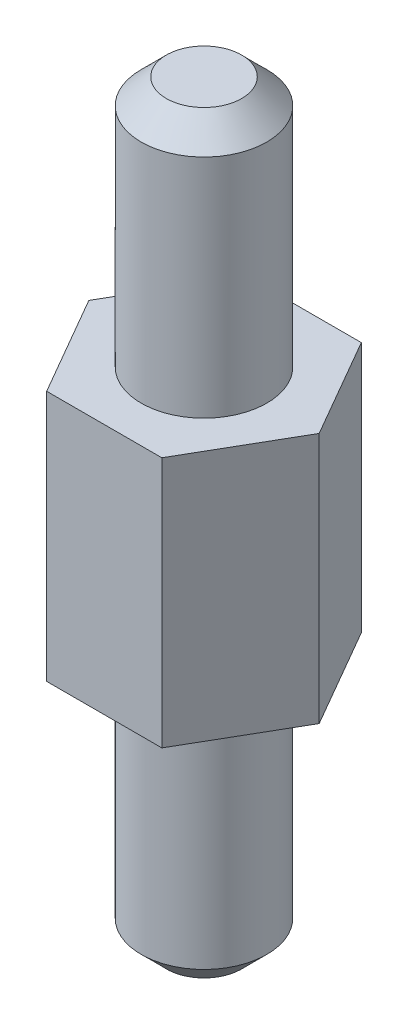
from build123d import *

# Parameters (mm, degrees)
EXTRUDE_1_DEPTH = 6
SKETCH_3_R      = 1.5
EXTRUDE_2_DEPTH = 6
EXTRUDE_START   = 6
SKETCH_4_R      = 1.5
EXTRUDE_3_DEPTH = 6
CHAMFER_1_SIZE  = 0.6


with BuildPart() as part:
    # Эскиз1 → Бобышка-Вытянуть1 (new body)
    with BuildSketch(Plane(origin=(0, 0, 0), x_dir=(1, 0, 0), z_dir=(0, 1, 0))):
        Polygon((-2.75, 0), (-1.375, 2.38156986), (1.375, 2.38156986), (2.75, 0), (1.375, -2.38156986), (-1.375, -2.38156986), align=None)
    extrude(amount=EXTRUDE_1_DEPTH)

    # Эскиз3 → Бобышка-Вытянуть2 (add)
    with BuildSketch(Plane(origin=(0, 6, 0), x_dir=(1, 0, 0), z_dir=(0, 1, 0))):
        with Locations(Location((0, 0, 0), (0, 0, 90))):
            Circle(SKETCH_3_R)
    extrude(amount=EXTRUDE_2_DEPTH)

    # Эскиз4 → Бобышка-Вытянуть3 (add)
    with BuildSketch(Plane.XZ.offset(EXTRUDE_START)):
        with Locations(Location((0, 0, 0), (0, 0, 270))):
            Circle(SKETCH_4_R)
    extrude(amount=-EXTRUDE_3_DEPTH)

    # Фаска1
    chamfer_1_edges = [part.edges().sort_by_distance(p)[0] for p in [
        (0, 12, 1.5),
        (0, -6, 1.5),
    ]]
    chamfer(chamfer_1_edges, length=CHAMFER_1_SIZE)


solid = part.part
